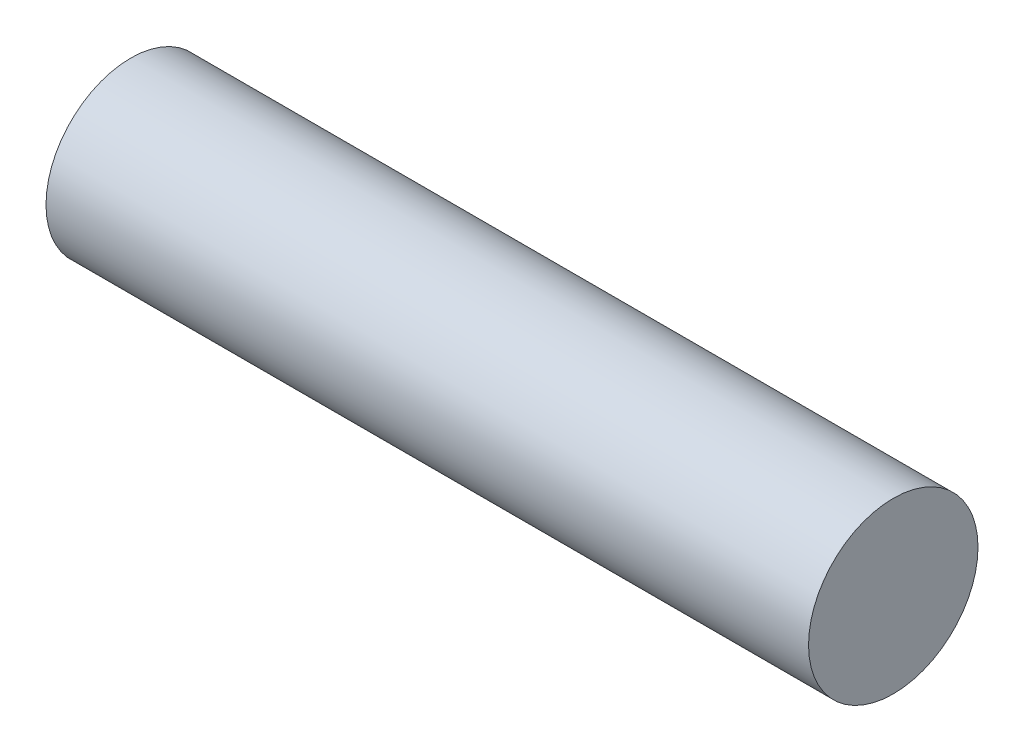
from build123d import *

# Parameters (mm, degrees)
SKETCH1_R           = 1
BOSS_EXTRUDE1_DEPTH = 9


with BuildPart() as part:
    # Sketch1 → Boss-Extrude1 (new body)
    with BuildSketch(Plane(origin=(0, 0, 0), x_dir=(0, 0, -1), z_dir=(1, 0, 0))):
        Circle(SKETCH1_R)
    extrude(amount=BOSS_EXTRUDE1_DEPTH)


solid = part.part
